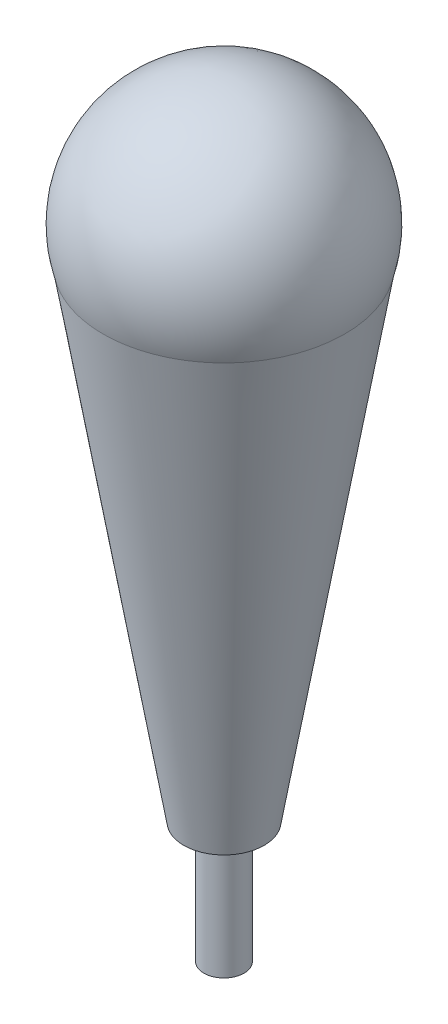
from build123d import *

# Parameters (mm, degrees)
SKETCH2_R           = 6.35
SKETCH3_R           = 19.05
SKETCH4_R           = 3.175
BOSS_EXTRUDE1_DEPTH = 19.05
DOME1_FACE_RADIUS   = 19.05
DOME1_HEIGHT        = 25.4


with BuildPart() as part:
    # Sketch2 → Loft1 section 0
    with BuildSketch(Plane(origin=(0, 0, 0), x_dir=(1, 0, 0), z_dir=(0, 1, 0))):
        Circle(SKETCH2_R)
    # Sketch3 → Loft1 section 1
    with BuildSketch(Plane(origin=(0, 76.2, 0), x_dir=(1, 0, 0), z_dir=(0, 1, 0))):
        Circle(SKETCH3_R)
    loft()

    # Sketch4 → Boss-Extrude1 (add)
    with BuildSketch(Plane.XZ):
        with Locations(Location((0, 0, 0), (0, 0, 90))):
            Circle(SKETCH4_R)
    extrude(amount=BOSS_EXTRUDE1_DEPTH)

    # Dome1: a dome of height H over a round flat face of radius A is a cap of a sphere of radius (A * A + H * H) / (2 * H)
    dome1_r = (DOME1_FACE_RADIUS * DOME1_FACE_RADIUS + DOME1_HEIGHT * DOME1_HEIGHT) / (2 * DOME1_HEIGHT)
    dome1_base = Plane((0, 76.2, 0), z_dir=(0, 1, 0))
    with Locations(dome1_base.offset(DOME1_HEIGHT - dome1_r)):
        dome1_ball = Sphere(dome1_r, mode=Mode.PRIVATE)
    add(split(dome1_ball, bisect_by=dome1_base, keep=Keep.TOP, mode=Mode.PRIVATE))


solid = part.part
